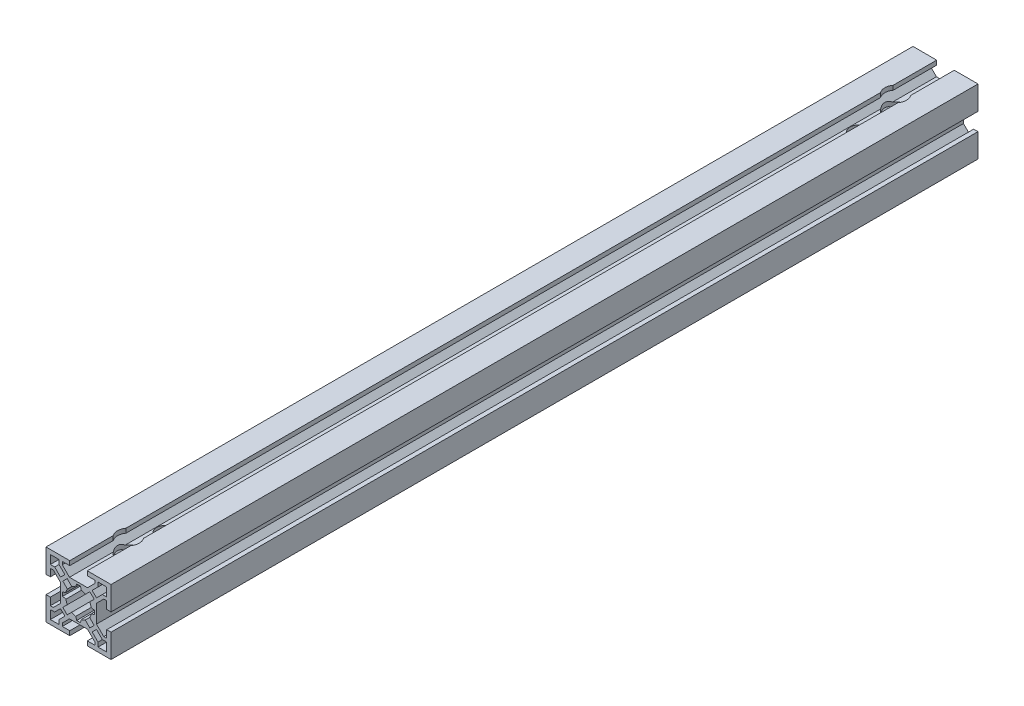
from build123d import *

# Parameters (mm, degrees)
RESSALTO_EXTRUS_O1_DEPTH   = 200
CORTE_EXTRUS_O1_DEPTH      = 202.121853611
CORTE_EXTRUS_O1_DEPTH_BACK = 202.121853611
ESBO_O2_R                  = 4
ESBO_O2_R_2                = 5


with BuildPart() as part:
    # Esboço1 → Ressalto-extrusão1 (new, symmetric)
    with BuildSketch(Plane.XY):
        Polygon((-13, -4.05), (-15, -4.05), (-15, -15), (-4.05, -15), (-4.05, -13), (-7.5, -13), (-7.5, -11.627272727), (-4.172727273, -8.3), (4.172727273, -8.3), (7.5, -11.627272727), (7.5, -13), (4.05, -13), (4.05, -15), (15, -15), (15, -4.05), (13, -4.05), (13, -7.5), (11.627272727, -7.5), (8.3, -4.172727273), (8.3, 4.172727273), (11.627272727, 7.5), (13, 7.5), (13, 4.05), (15, 4.05), (15, 15), (4.05, 15), (4.05, 13), (7.5, 13), (7.5, 11.627272727), (4.172727273, 8.3), (-4.172727273, 8.3), (-7.5, 11.627272727), (-7.5, 13), (-4.05, 13), (-4.05, 15), (-15, 15), (-15, 4.05), (-13, 4.05), (-13, 7.5), (-11.627272727, 7.5), (-8.3, 4.172727273), (-8.3, -4.172727273), (-11.627272727, -7.5), (-13, -7.5), align=None)
        with BuildLine():
            Line((-7.239339828, -5.233387445), (-5.125358847, -3.119406464))
            ThreePointArc((-5.125358847, -3.119406464), (-5.566897716, -2.238224702), (-5.858217272, -1.296645823))
            Line((-5.858217272, -1.296645823), (-7.3, -0.859788435))
            Line((-7.3, -0.859788435), (-7.3, 0.859788435))
            Line((-7.3, 0.859788435), (-5.858217272, 1.296645823))
            ThreePointArc((-5.858217272, 1.296645823), (-5.566897716, 2.238224702), (-5.125358847, 3.119406464))
            Line((-5.125358847, 3.119406464), (-7.239339828, 5.233387445))
            Line((-7.239339828, 5.233387445), (-5.233387445, 7.239339828))
            Line((-5.233387445, 7.239339828), (-3.119406464, 5.125358847))
            ThreePointArc((-3.119406464, 5.125358847), (-2.238224702, 5.566897716), (-1.296645823, 5.858217272))
            Line((-1.296645823, 5.858217272), (-0.859788435, 7.3))
            Line((-0.859788435, 7.3), (0.859788435, 7.3))
            Line((0.859788435, 7.3), (1.296645823, 5.858217272))
            ThreePointArc((1.296645823, 5.858217272), (2.238224702, 5.566897716), (3.119406464, 5.125358847))
            Line((3.119406464, 5.125358847), (5.233387445, 7.239339828))
            Line((5.233387445, 7.239339828), (7.239339828, 5.233387445))
            Line((7.239339828, 5.233387445), (5.125358847, 3.119406464))
            ThreePointArc((5.125358847, 3.119406464), (5.566897716, 2.238224702), (5.858217272, 1.296645823))
            Line((5.858217272, 1.296645823), (7.3, 0.859788435))
            Line((7.3, 0.859788435), (7.3, -0.859788435))
            Line((7.3, -0.859788435), (5.858217272, -1.296645823))
            ThreePointArc((5.858217272, -1.296645823), (5.566897716, -2.238224702), (5.125358847, -3.119406464))
            Line((5.125358847, -3.119406464), (7.239339828, -5.233387445))
            Line((7.239339828, -5.233387445), (5.233387445, -7.239339828))
            Line((5.233387445, -7.239339828), (3.119406464, -5.125358847))
            ThreePointArc((3.119406464, -5.125358847), (2.238224702, -5.566897716), (1.296645823, -5.858217272))
            Line((1.296645823, -5.858217272), (0.859788435, -7.3))
            Line((0.859788435, -7.3), (-0.859788435, -7.3))
            Line((-0.859788435, -7.3), (-1.296645823, -5.858217272))
            ThreePointArc((-1.296645823, -5.858217272), (-2.238224702, -5.566897716), (-3.119406464, -5.125358847))
            Line((-3.119406464, -5.125358847), (-5.233387445, -7.239339828))
            Line((-5.233387445, -7.239339828), (-7.239339828, -5.233387445))
        make_face(mode=Mode.SUBTRACT)
        Polygon((-11.005952384, -9), (-13, -9), (-13, -13), (-9, -13), (-9, -11.005952384), (-6.294047616, -8.3), (-8.3, -6.294047616), align=None, mode=Mode.SUBTRACT)
        Polygon((9, -11.005952384), (9, -13), (13, -13), (13, -9), (11.005952384, -9), (8.3, -6.294047616), (6.294047616, -8.3), align=None, mode=Mode.SUBTRACT)
        Polygon((11.005952384, 9), (13, 9), (13, 13), (9, 13), (9, 11.005952384), (6.294047616, 8.3), (8.3, 6.294047616), align=None, mode=Mode.SUBTRACT)
        Polygon((-9, 11.005952384), (-9, 13), (-13, 13), (-13, 9), (-11.005952384, 9), (-8.3, 6.294047616), (-6.294047616, 8.3), align=None, mode=Mode.SUBTRACT)
    extrude(amount=RESSALTO_EXTRUS_O1_DEPTH, both=True)

    # Esboço2 → Corte-extrusão1 (cut, two sides: drawn at the far end of the back side and taken through both)
    with BuildSketch(Plane(origin=(0, 0, 0), x_dir=(1, 0, 0), z_dir=(0, 1, 0)).offset(-CORTE_EXTRUS_O1_DEPTH_BACK)):
        with Locations(Location((0, -160, 0), (0, 0, 282.412424309))):
            Circle(ESBO_O2_R)
        with Locations(Location((0, 160, 0), (0, 0, 282.412424309))):
            Circle(ESBO_O2_R)
        with Locations(Location((0, -177, 0), (0, 0, 279.901662659))):
            Circle(ESBO_O2_R_2)
        with Locations(Location((0, 177, 0), (0, 0, 279.901662659))):
            Circle(ESBO_O2_R_2)
    extrude(amount=CORTE_EXTRUS_O1_DEPTH + CORTE_EXTRUS_O1_DEPTH_BACK, mode=Mode.SUBTRACT)


solid = part.part
